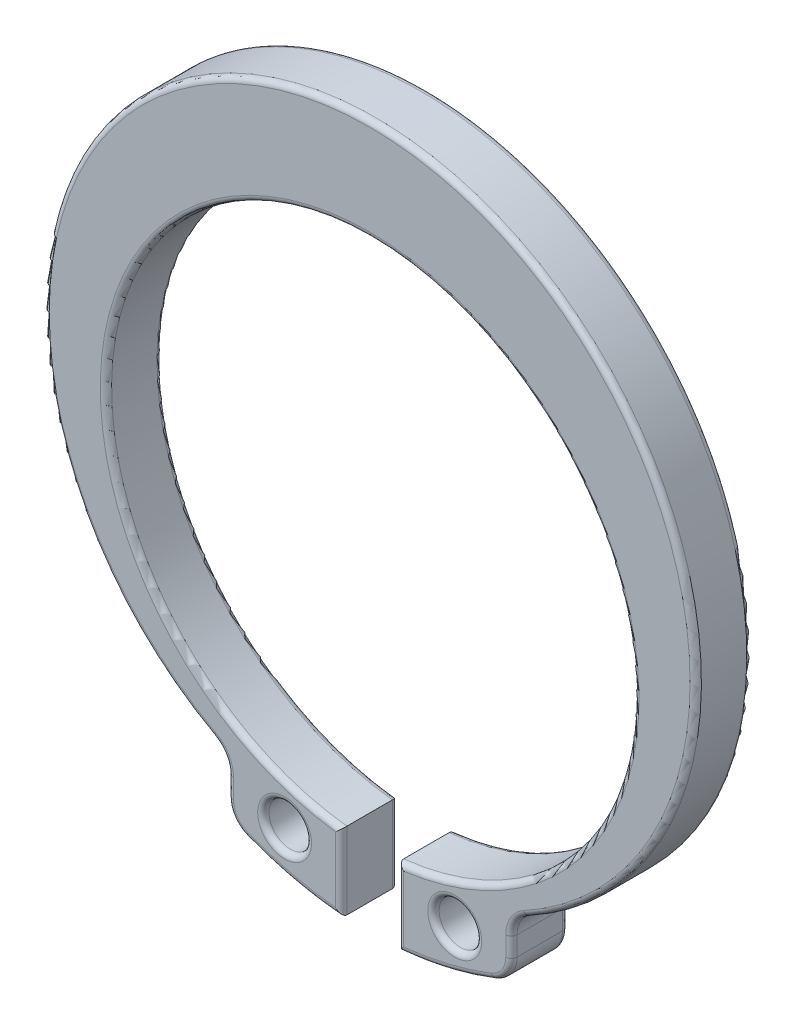
from build123d import *

# Parameters (mm, degrees)
SKETCH_1_R          = 5.75
SKETCH_1_R_2        = 4.65
EXTRUDE_1_DEPTH     = 1
EXTRUDE_2_DEPTH     = 1
SKETCH_4_R          = 0.375
SKETCH_4_W          = 1
SKETCH_4_H          = 1.40391975
CUT_EXTRUDE_1_DEPTH = 1
FILLET_3_R          = 0.5
FILLET_2_R          = 0.1


with BuildPart() as part:
    # 草图1 → 凸台-拉伸1 (new body)
    with BuildSketch(Plane.XY):
        with Locations((0, 0.7)):
            Circle(SKETCH_1_R)
        Circle(SKETCH_1_R_2, mode=Mode.SUBTRACT)
    extrude(amount=EXTRUDE_1_DEPTH)

    # 草图3 → 凸台-拉伸2 (add)
    with BuildSketch(Plane.XY):
        with BuildLine():
            Line((2.5, -4.478078794), (2.5, -5.454356057))
            ThreePointArc((2.5, -5.454356057), (0, -6), (-2.5, -5.454356057))
            Line((-2.5, -5.454356057), (-2.5, -4.478078794))
            ThreePointArc((-2.5, -4.478078794), (0, -5.05), (2.5, -4.478078794))
        make_face()
    extrude(amount=EXTRUDE_2_DEPTH)

    # 草图4 → 切除-拉伸1 (cut)
    with BuildSketch(Plane.XY.offset(1)):
        with Locations((1.5, -5.1)):
            Circle(SKETCH_4_R)
        with Locations(Location((-1.5, -5.1, 0), (0, 0, 180))):
            Circle(SKETCH_4_R)
        with Locations((0, -5.325)):
            Rectangle(SKETCH_4_W, SKETCH_4_H)
    extrude(amount=-CUT_EXTRUDE_1_DEPTH, mode=Mode.SUBTRACT)

    # 圆角3
    fillet_3_edges = [part.edges().sort_by_distance(p)[0] for p in [
        (2.5, -4.478078794, 0.5),
        (-2.5, -4.478078794, 0.5),
        (-2.5, -5.454356057, 0.5),
        (2.5, -5.454356057, 0.5),
    ]]
    fillet(fillet_3_edges, radius=FILLET_3_R)

    # 圆角2
    fillet_2_edges = [part.edges().sort_by_distance(p)[0] for p in [
        (1.355005414, -5.844994468, 0),
        (1.355005414, -5.844994468, 1),
        (0, 4.65, 1),
        (0, 4.65, 0),
        (1.125, -5.1, 0),
        (1.125, -5.1, 1),
        (-1.125, -5.1, 0),
        (-1.125, -5.1, 1),
        (0.5, -5.301085248, 0),
        (-0.5, -5.301085248, 0),
        (0.5, -5.301085248, 1),
        (-0.5, -5.301085248, 1),
        (2.5, -4.953201716, 0),
        (2.5, -4.953201716, 1),
        (-1.355005414, -5.844994468, 0),
        (-2.5, -4.953201716, 0),
        (0, 6.45, 0),
        (-2.412861412, -5.40551342, 0),
        (2.412861412, -5.40551342, 0),
        (0, 6.45, 1),
        (-2.5, -4.953201716, 1),
        (-1.355005414, -5.844994468, 1),
        (-2.412861412, -5.40551342, 1),
        (2.412861412, -5.40551342, 1),
        (2.569883737, -4.527977074, 0),
        (2.569883737, -4.527977074, 1),
        (-2.569883737, -4.527977074, 0),
        (-2.569883737, -4.527977074, 1),
    ]]
    fillet(fillet_2_edges, radius=FILLET_2_R)


solid = part.part
